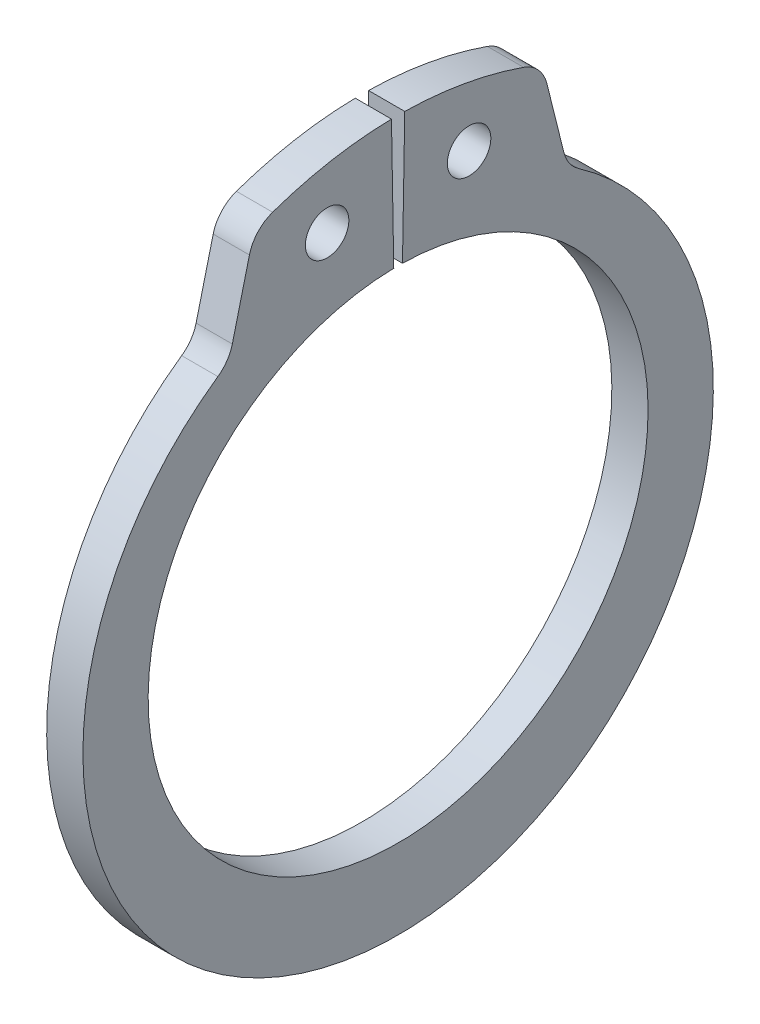
from build123d import *

# Parameters (mm, degrees)
SKETCH1_R           = 0.6
BOSS_EXTRUDE1_DEPTH = 1


with BuildPart() as part:
    # Sketch1 → Boss-Extrude1 (new body)
    with BuildSketch(Plane(origin=(-0.5, 0, 0), x_dir=(0, -1, 0), z_dir=(-1, 0, 0))):
        with BuildLine():
            Line((-10.498400799, 0.183250268), (-6.898949097, 0.120421604))
            ThreePointArc((-6.898949097, 0.120421604), (6.9, 0), (-6.898949097, -0.120421604))
            Line((-6.898949097, -0.120421604), (-10.498400799, -0.183250268))
            ThreePointArc((-10.498400799, -0.183250268), (-10.336277455, -1.846989003), (-9.912178879, -3.463915395))
            ThreePointArc((-9.912178879, -3.463915395), (-9.642061327, -3.872841732), (-9.210083739, -4.104314417))
            Line((-9.210083739, -4.104314417), (-7.317615309, -4.576159791))
            ThreePointArc((-7.317615309, -4.576159791), (-6.992215183, -4.722959481), (-6.73911196, -4.974701709))
            ThreePointArc((-6.73911196, -4.974701709), (9.1, 0), (-6.73911196, 4.974701709))
            ThreePointArc((-6.73911196, 4.974701709), (-6.992215183, 4.722959481), (-7.317615309, 4.576159791))
            Line((-7.317615309, 4.576159791), (-9.210083739, 4.104314417))
            ThreePointArc((-9.210083739, 4.104314417), (-9.642061327, 3.872841732), (-9.912178879, 3.463915395))
            ThreePointArc((-9.912178879, 3.463915395), (-10.336277455, 1.846989003), (-10.498400799, 0.183250268))
        make_face()
        with Locations(Location((-8.667119805, -1.959628832, 0), (0, 0, 270))):
            Circle(SKETCH1_R, mode=Mode.SUBTRACT)
        with Locations(Location((-8.667119805, 1.959628832, 0), (0, 0, 270))):
            Circle(SKETCH1_R, mode=Mode.SUBTRACT)
    extrude(amount=-BOSS_EXTRUDE1_DEPTH)


solid = part.part
